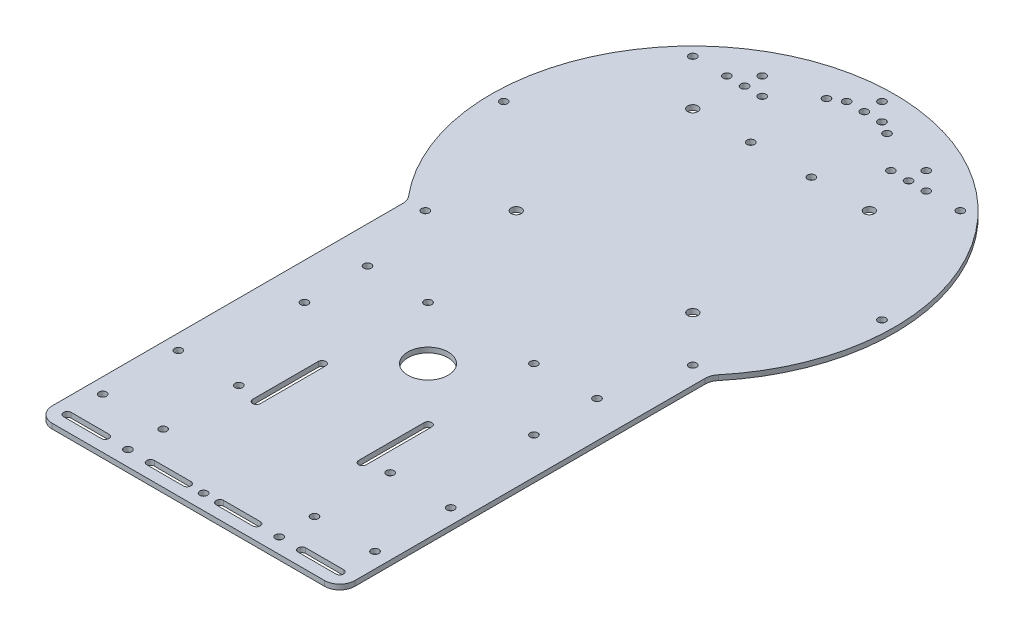
from build123d import *

# Parameters (mm, degrees)
SKETCH_1_R      = 2
SKETCH_1_R_2    = 1.5
SKETCH_1_R_3    = 8
EXTRUDE_1_DEPTH = 2


with BuildPart() as part:
    # 草图1 → 凸台-拉伸1 (new body)
    with BuildSketch(Plane(origin=(0, 0, 0), x_dir=(1, 0, 0), z_dir=(0, 1, 0))):
        with BuildLine():
            Line((394.734384308, 186.437991397), (394.734384308, 47.57418904))
            ThreePointArc((394.734384308, 47.57418904), (392.977024848, 43.331548206), (388.734383891, 41.574189041))
            Line((388.734383891, 41.574189041), (280.734383891, 41.574189041))
            ThreePointArc((280.734383891, 41.574189041), (276.491743204, 43.331548353), (274.734383891, 47.57418904))
            Line((274.734383891, 47.57418904), (274.734383891, 186.437990955))
            ThreePointArc((274.734383891, 186.437990955), (274.37476968, 188.483975832), (273.339034487, 190.284705991))
            ThreePointArc((273.339034487, 190.284705991), (334.734382872, 321.574189041), (396.129734602, 190.284707555))
            ThreePointArc((396.129734602, 190.284707555), (395.093998746, 188.483976956), (394.734384308, 186.437991397))
        make_face()
        with Locations(Location((369.73616956, 276.575974709, 0), (0, 0, 270))):
            Circle(SKETCH_1_R, mode=Mode.SUBTRACT)
        with Locations(Location((369.73616956, 206.572403372, 0), (0, 0, 270))):
            Circle(SKETCH_1_R, mode=Mode.SUBTRACT)
        with Locations(Location((299.732598222, 206.572403372, 0), (0, 0, 270))):
            Circle(SKETCH_1_R, mode=Mode.SUBTRACT)
        with Locations(Location((313.734383891, 157.57418904, 0), (0, 0, 270))):
            Circle(SKETCH_1_R_2, mode=Mode.SUBTRACT)
        with Locations(Location((355.734383891, 157.57418904, 0), (0, 0, 270))):
            Circle(SKETCH_1_R_2, mode=Mode.SUBTRACT)
        with Locations(Location((380.234383891, 133.07418904, 0), (0, 0, 270))):
            Circle(SKETCH_1_R_2, mode=Mode.SUBTRACT)
        with Locations(Location((380.234383891, 158.07418904, 0), (0, 0, 270))):
            Circle(SKETCH_1_R_2, mode=Mode.SUBTRACT)
        with Locations(Location((364.734383891, 61.57418904, 0), (0, 0, 270))):
            Circle(SKETCH_1_R_2, mode=Mode.SUBTRACT)
        with Locations(Location((388.734383891, 61.57418904, 0), (0, 0, 270))):
            Circle(SKETCH_1_R_2, mode=Mode.SUBTRACT)
        with Locations(Location((364.734383891, 91.57418904, 0), (0, 0, 270))):
            Circle(SKETCH_1_R_2, mode=Mode.SUBTRACT)
        with Locations(Location((388.734383891, 91.57418904, 0), (0, 0, 270))):
            Circle(SKETCH_1_R_2, mode=Mode.SUBTRACT)
        with Locations(Location((304.734383891, 61.57418904, 0), (0, 0, 270))):
            Circle(SKETCH_1_R_2, mode=Mode.SUBTRACT)
        with Locations(Location((280.734383891, 61.57418904, 0), (0, 0, 270))):
            Circle(SKETCH_1_R_2, mode=Mode.SUBTRACT)
        with Locations(Location((304.734383891, 91.57418904, 0), (0, 0, 270))):
            Circle(SKETCH_1_R_2, mode=Mode.SUBTRACT)
        with Locations(Location((280.734383891, 91.57418904, 0), (0, 0, 270))):
            Circle(SKETCH_1_R_2, mode=Mode.SUBTRACT)
        with Locations(Location((334.734383891, 316.57418904, 0), (0, 0, 270))):
            Circle(SKETCH_1_R_2, mode=Mode.SUBTRACT)
        with Locations(Location((281.701375302, 294.607197629, 0), (0, 0, 270))):
            Circle(SKETCH_1_R_2, mode=Mode.SUBTRACT)
        with Locations(Location((259.734383891, 241.574189041, 0), (0, 0, 270))):
            Circle(SKETCH_1_R_2, mode=Mode.SUBTRACT)
        with Locations(Location((281.701375302, 188.541180451, 0), (0, 0, 270))):
            Circle(SKETCH_1_R_2, mode=Mode.SUBTRACT)
        with Locations(Location((387.76739248, 188.541180451, 0), (0, 0, 270))):
            Circle(SKETCH_1_R_2, mode=Mode.SUBTRACT)
        with Locations(Location((409.734383891, 241.574189041, 0), (0, 0, 270))):
            Circle(SKETCH_1_R_2, mode=Mode.SUBTRACT)
        with Locations(Location((387.76739248, 294.607197629, 0), (0, 0, 270))):
            Circle(SKETCH_1_R_2, mode=Mode.SUBTRACT)
        with Locations(Location((322.734383891, 306.575974709, 0), (0, 0, 270))):
            Circle(SKETCH_1_R_2, mode=Mode.SUBTRACT)
        with Locations(Location((346.734383891, 306.575974709, 0), (0, 0, 270))):
            Circle(SKETCH_1_R_2, mode=Mode.SUBTRACT)
        with Locations(Location((322.734383891, 276.575974709, 0), (0, 0, 270))):
            Circle(SKETCH_1_R_2, mode=Mode.SUBTRACT)
        with Locations(Location((346.734383891, 276.575974709, 0), (0, 0, 270))):
            Circle(SKETCH_1_R_2, mode=Mode.SUBTRACT)
        with Locations(Location((334.734383891, 309.57418904, 0), (0, 0, 270))):
            Circle(SKETCH_1_R_2, mode=Mode.SUBTRACT)
        with Locations(Location((341.734383891, 309.57418904, 0), (0, 0, 270))):
            Circle(SKETCH_1_R_2, mode=Mode.SUBTRACT)
        with Locations(Location((327.734383891, 309.57418904, 0), (0, 0, 270))):
            Circle(SKETCH_1_R_2, mode=Mode.SUBTRACT)
        with Locations(Location((302.217879596, 301.607197629, 0), (0, 0, 270))):
            Circle(SKETCH_1_R_2, mode=Mode.SUBTRACT)
        with Locations(Location((302.217879596, 294.607197629, 0), (0, 0, 270))):
            Circle(SKETCH_1_R_2, mode=Mode.SUBTRACT)
        with Locations(Location((309.217879596, 294.607197629, 0), (0, 0, 270))):
            Circle(SKETCH_1_R_2, mode=Mode.SUBTRACT)
        with Locations(Location((295.217879596, 294.607197629, 0), (0, 0, 270))):
            Circle(SKETCH_1_R_2, mode=Mode.SUBTRACT)
        with Locations(Location((367.250888185, 301.607197629, 0), (0, 0, 270))):
            Circle(SKETCH_1_R_2, mode=Mode.SUBTRACT)
        with Locations(Location((367.250888185, 294.607197629, 0), (0, 0, 270))):
            Circle(SKETCH_1_R_2, mode=Mode.SUBTRACT)
        with Locations(Location((360.250888185, 294.607197629, 0), (0, 0, 270))):
            Circle(SKETCH_1_R_2, mode=Mode.SUBTRACT)
        with Locations(Location((374.250888185, 294.607197629, 0), (0, 0, 270))):
            Circle(SKETCH_1_R_2, mode=Mode.SUBTRACT)
        with Locations(Location((289.234383891, 133.07418904, 0), (0, 0, 270))):
            Circle(SKETCH_1_R_2, mode=Mode.SUBTRACT)
        with Locations(Location((289.234383891, 158.07418904, 0), (0, 0, 270))):
            Circle(SKETCH_1_R_2, mode=Mode.SUBTRACT)
        with Locations(Location((304.734383891, 47.57418904, 0), (0, 0, 270))):
            Circle(SKETCH_1_R_2, mode=Mode.SUBTRACT)
        with Locations(Location((364.734383891, 47.57418904, 0), (0, 0, 270))):
            Circle(SKETCH_1_R_2, mode=Mode.SUBTRACT)
        with Locations(Location((334.734383891, 47.57418904, 0), (0, 0, 270))):
            Circle(SKETCH_1_R_2, mode=Mode.SUBTRACT)
        with Locations(Location((334.734383891, 136.57418904, 0), (0, 0, 270))):
            Circle(SKETCH_1_R_3, mode=Mode.SUBTRACT)
        with Locations(Location((299.732598222, 276.575974709, 0), (0, 0, 270))):
            Circle(SKETCH_1_R, mode=Mode.SUBTRACT)
        with BuildLine():
            Line((354.234383891, 115.57418904), (354.234383891, 89.57418904))
            ThreePointArc((354.234383891, 89.57418904), (355.734383891, 88.07418904), (357.234383891, 89.57418904))
            Line((357.234383891, 89.57418904), (357.234383891, 115.57418904))
            ThreePointArc((357.234383891, 115.57418904), (355.734383891, 117.07418904), (354.234383891, 115.57418904))
        make_face(mode=Mode.SUBTRACT)
        with BuildLine():
            Line((312.234383891, 115.57418904), (312.234383891, 89.57418904))
            ThreePointArc((312.234383891, 89.57418904), (313.734383891, 88.07418904), (315.234383891, 89.57418904))
            Line((315.234383891, 89.57418904), (315.234383891, 115.57418904))
            ThreePointArc((315.234383891, 115.57418904), (313.734383891, 117.07418904), (312.234383891, 115.57418904))
        make_face(mode=Mode.SUBTRACT)
        with BuildLine():
            Line((373.73438389, 46.07418904), (388.734383949, 46.07418904))
            ThreePointArc((388.734383949, 46.07418904), (390.234384308, 47.574188681), (388.734384668, 49.07418904))
            Line((388.734384668, 49.07418904), (373.734383891, 49.07418904))
            ThreePointArc((373.734383891, 49.07418904), (372.234383891, 47.574189041), (373.73438389, 46.07418904))
        make_face(mode=Mode.SUBTRACT)
        with BuildLine():
            Line((295.734383891, 49.07418904), (280.734383933, 49.07418904))
            ThreePointArc((280.734383933, 49.07418904), (279.234383891, 47.574189156), (280.734383701, 46.07418904))
            Line((280.734383701, 46.07418904), (295.734383891, 46.07418904))
            ThreePointArc((295.734383891, 46.07418904), (297.234383891, 47.57418904), (295.734383891, 49.07418904))
        make_face(mode=Mode.SUBTRACT)
        with BuildLine():
            Line((341.23438389, 46.07418904), (355.734383901, 46.07418904))
            ThreePointArc((355.734383901, 46.07418904), (357.234383363, 47.574189579), (355.734382825, 49.07418904))
            Line((355.734382825, 49.07418904), (341.234383891, 49.07418904))
            ThreePointArc((341.234383891, 49.07418904), (339.734383891, 47.574189041), (341.23438389, 46.07418904))
        make_face(mode=Mode.SUBTRACT)
        with BuildLine():
            Line((328.234383891, 49.07418904), (313.734383817, 49.07418904))
            ThreePointArc((313.734383817, 49.07418904), (312.234383891, 47.5741895), (313.734382898, 46.07418904))
            Line((313.734382898, 46.07418904), (328.234383891, 46.07418904))
            ThreePointArc((328.234383891, 46.07418904), (329.734383891, 47.57418904), (328.234383891, 49.07418904))
        make_face(mode=Mode.SUBTRACT)
    extrude(amount=EXTRUDE_1_DEPTH)


solid = part.part
